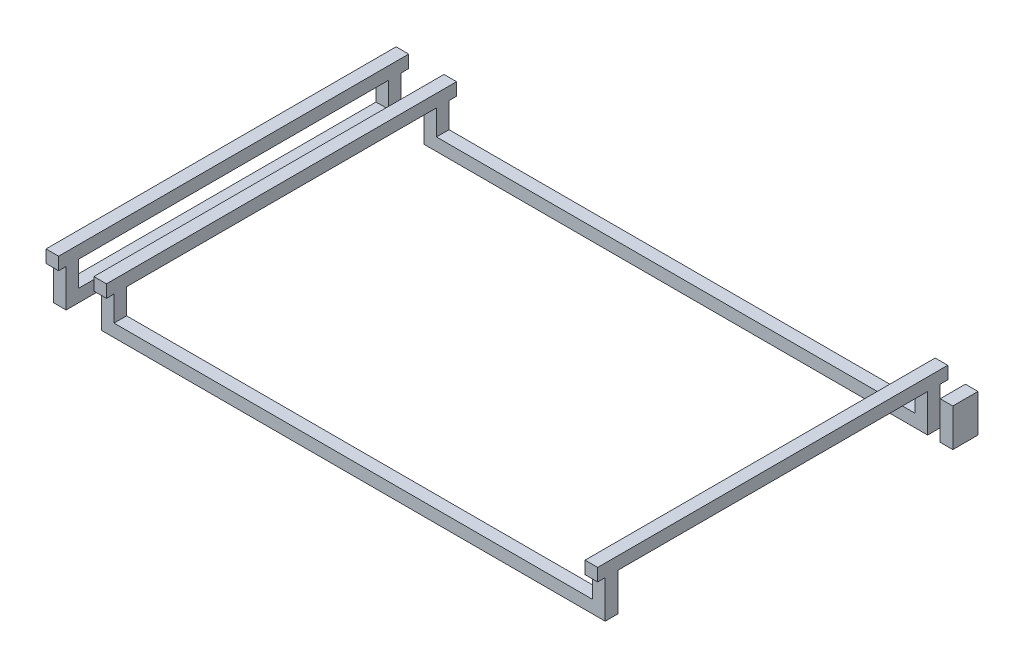
from build123d import *

# Parameters (mm, degrees)
ESQUISSE1_W                  = 1000
ESQUISSE1_H                  = 25
ESQUISSE1_W_2                = 25
ESQUISSE1_H_2                = 665
BOSS_EXTRU_1_DEPTH           = 25
ESQUISSE2_R                  = 2.75
ENL_V_MAT_EXTRU_1_DEPTH      = 2
ESQUISSE4_W                  = 25
ESQUISSE4_H                  = 25
ESQUISSE4_W_2                = 50
ESQUISSE4_H_2                = 50
BOSS_EXTRU_3_DEPTH           = 75
ESQUISSE5_W                  = 25
ESQUISSE5_H                  = 20
ESQUISSE5_H_2                = 665
ESQUISSE5_H_3                = 25
ESQUISSE5_H_4                = 45
BOSS_EXTRU_4_DEPTH           = 25
ESQUISSE7_W                  = 615
ESQUISSE7_H                  = 25
ENL_V_MAT_EXTRU_2_DEPTH      = 1188
ESQUISSE8_W                  = 25
ESQUISSE8_H                  = 25
BOSS_EXTRU_7_DEPTH           = 50
ENL_V_MAT_EXTRU_3_DEPTH      = 216
ENL_V_MAT_EXTRU_3_DEPTH_BACK = 926
ESQUISSE9_W                  = 25
ESQUISSE9_H                  = 110.20058498
ESQUISSE9_H_2                = 152.237643614
ESQUISSE10_W                 = 25
ESQUISSE10_H                 = 640
ESQUISSE10_H_2               = 25
ESQUISSE10_H_3               = 15
ESQUISSE10_H_4               = 665
BOSS_EXTRU_8_DEPTH           = 25
ESQUISSE12_W                 = 25
ESQUISSE12_H                 = 695
BOSS_EXTRU_10_DEPTH          = 25
ESQUISSE13_W                 = 25
ESQUISSE13_H                 = 25
BOSS_EXTRU_11_DEPTH          = 50
ESQUISSE14_W                 = 25
ESQUISSE14_H                 = 665
BOSS_EXTRU_12_DEPTH          = 25


with BuildPart() as part:
    # Esquisse1 → Boss.-Extru.1 (new body)
    with BuildSketch(Plane(origin=(0, 0, 0), x_dir=(1, 0, 0), z_dir=(0, 1, 0))):
        with Locations((295.960935162, -141.198785334)):
            Rectangle(ESQUISSE1_W, ESQUISSE1_H)
        with Locations((295.960935162, 498.801214666)):
            Rectangle(ESQUISSE1_W, ESQUISSE1_H)
        with Locations((-216.539064838, 178.801214666)):
            Rectangle(ESQUISSE1_W_2, ESQUISSE1_H_2)
        with Locations((808.460935162, 178.801214666)):
            Rectangle(ESQUISSE1_W_2, ESQUISSE1_H_2)
    extrude(amount=BOSS_EXTRU_1_DEPTH)

    # Esquisse2 → Enlèv. mat.-Extru.1 (cut)
    with BuildSketch(Plane(origin=(0, 25, 0), x_dir=(1, 0, 0), z_dir=(0, 1, 0))):
        with Locations(Location((-184.039064838, -141.198785334, 0), (0, 0, 270))):
            Circle(ESQUISSE2_R)
        with Locations(Location((775.960935162, -141.198785334, 0), (0, 0, 270))):
            Circle(ESQUISSE2_R)
        with Locations(Location((775.960935162, 498.801214666, 0), (0, 0, 270))):
            Circle(ESQUISSE2_R)
        with Locations(Location((-184.039064838, 498.801214666, 0), (0, 0, 270))):
            Circle(ESQUISSE2_R)
    extrude(amount=-ENL_V_MAT_EXTRU_1_DEPTH, mode=Mode.SUBTRACT)

    # Esquisse4 → Boss.-Extru.3 (add)
    with BuildSketch(Plane.XZ):
        with Locations((808.460935162, 141.198785334)):
            Rectangle(ESQUISSE4_W, ESQUISSE4_H)
        with Locations((-216.539064838, 141.198785334)):
            Rectangle(ESQUISSE4_W, ESQUISSE4_H)
        with Locations((-216.539064838, -498.801214666)):
            Rectangle(ESQUISSE4_W, ESQUISSE4_H)
        with Locations((820.960935162, -511.301214666)):
            Rectangle(ESQUISSE4_W_2, ESQUISSE4_H_2)
    extrude(amount=-BOSS_EXTRU_3_DEPTH)

    # Esquisse5 → Boss.-Extru.4 (add)
    with BuildSketch(Plane(origin=(0, 75, 0), x_dir=(1, 0, 0), z_dir=(0, 1, 0))):
        with Locations((808.460935162, -163.698785334)):
            Rectangle(ESQUISSE5_W, ESQUISSE5_H)
        with Locations((808.460935162, 203.801214666)):
            Rectangle(ESQUISSE5_W, ESQUISSE5_H_2)
        with Locations((808.460935162, -141.198785334)):
            Rectangle(ESQUISSE5_W, ESQUISSE5_H_3)
        with Locations((808.460935162, 546.301214666)):
            Rectangle(ESQUISSE5_W, ESQUISSE5_H)
        with Locations((-216.539064838, 178.801214666)):
            Rectangle(ESQUISSE5_W, ESQUISSE5_H_2)
        with Locations((-216.539064838, -163.698785334)):
            Rectangle(ESQUISSE5_W, ESQUISSE5_H)
        with Locations((-216.539064838, 533.801214666)):
            Rectangle(ESQUISSE5_W, ESQUISSE5_H_4)
    extrude(amount=BOSS_EXTRU_4_DEPTH)

    # Esquisse7 → Enlèv. mat.-Extru.2 (cut)
    with BuildSketch(Plane.ZY.offset(229.039064838)):
        with Locations((-178.801214666, 12.5)):
            Rectangle(ESQUISSE7_W, ESQUISSE7_H)
    extrude(amount=-ENL_V_MAT_EXTRU_2_DEPTH, mode=Mode.SUBTRACT)

    # Esquisse8 → Boss.-Extru.7 (add)
    with BuildSketch(Plane(origin=(0, 25, 0), x_dir=(1, 0, 0), z_dir=(0, 1, 0))):
        with Locations((783.460935162, 498.801214666)):
            Rectangle(ESQUISSE8_W, ESQUISSE8_H)
        with Locations((783.460935162, -141.198785334)):
            Rectangle(ESQUISSE8_W, ESQUISSE8_H)
        with Locations((-191.539064838, -141.198785334)):
            Rectangle(ESQUISSE8_W, ESQUISSE8_H)
        with Locations((-191.539064838, 498.801214666)):
            Rectangle(ESQUISSE8_W, ESQUISSE8_H)
    extrude(amount=BOSS_EXTRU_7_DEPTH)

    # Esquisse9 → Enlèv. mat.-Extru.3 (cut, two sides: drawn at the far end of the back side and taken through both)
    with BuildSketch(Plane(origin=(0, 0, -511.301214666), x_dir=(-1, 0, 0), z_dir=(0, 0, -1)).offset(-ENL_V_MAT_EXTRU_3_DEPTH_BACK)):
        with Locations((-808.460935162, 55.10029249)):
            Rectangle(ESQUISSE9_W, ESQUISSE9_H)
        with Locations((216.539064838, 76.118821807)):
            Rectangle(ESQUISSE9_W, ESQUISSE9_H_2)
    extrude(amount=ENL_V_MAT_EXTRU_3_DEPTH + ENL_V_MAT_EXTRU_3_DEPTH_BACK, mode=Mode.SUBTRACT)


with BuildPart() as enl_v_mat_extru_3_piece_1:
    # of the separate pieces the step leaves, piece 1, a body of its own (enl_v_mat_extru_3_pieces)
    add(part.part.solids().sort_by_distance((-204.039064838, 75, -486.301214666))[0])



with BuildPart() as enl_v_mat_extru_3_piece_2:
    # of the separate pieces the step leaves, piece 2, a body of its own (enl_v_mat_extru_3_pieces)
    add(part.part.solids().sort_by_distance((-204.039064838, 0, 153.698785334))[0])


with BuildPart() as enl_v_mat_extru_3_piece_3:
    # of the separate pieces the step leaves, piece 3, a body of its own (enl_v_mat_extru_3_pieces)
    add(part.part.solids().sort_by_distance((820.960935162, 75, -486.301214666))[0])


with BuildPart() as enl_v_mat_extru_3_piece_1_1:
    add(enl_v_mat_extru_3_piece_1.part)

    add(enl_v_mat_extru_3_piece_2.part)  # Boss.-Extru.8 merges Enlèv. mat.-Extru.3 piece 2
    # Esquisse10 → Boss.-Extru.8 (add)
    with BuildSketch(Plane(origin=(0, 75, 0), x_dir=(1, 0, 0), z_dir=(0, 1, 0))):
        with Locations((783.460935162, 191.301214666)):
            Rectangle(ESQUISSE10_W, ESQUISSE10_H)
        with Locations((783.460935162, -141.198785334)):
            Rectangle(ESQUISSE10_W, ESQUISSE10_H_2)
        with Locations((783.460935162, -161.198785334)):
            Rectangle(ESQUISSE10_W, ESQUISSE10_H_3)
        with Locations((783.460935162, 518.801214666)):
            Rectangle(ESQUISSE10_W, ESQUISSE10_H_3)
        with Locations((-191.539064838, -161.198785334)):
            Rectangle(ESQUISSE10_W, ESQUISSE10_H_3)
        with Locations((-191.539064838, 178.801214666)):
            Rectangle(ESQUISSE10_W, ESQUISSE10_H_4)
        with Locations((-191.539064838, 518.801214666)):
            Rectangle(ESQUISSE10_W, ESQUISSE10_H_3)
    extrude(amount=BOSS_EXTRU_8_DEPTH)


with BuildPart() as body_3:
    # Esquisse12 → Boss.-Extru.10 (new body)
    with BuildSketch(Plane(origin=(0, 100, 0), x_dir=(1, 0, 0), z_dir=(0, 1, 0))):
        with Locations((-286.539064838, 178.801214666)):
            Rectangle(ESQUISSE12_W, ESQUISSE12_H)
    extrude(amount=-BOSS_EXTRU_10_DEPTH)

    # Esquisse13 → Boss.-Extru.11 (add)
    with BuildSketch(Plane(origin=(0, 75, 0), x_dir=(-1, 0, 0), z_dir=(0, -1, 0))):
        with Locations((286.539064838, 498.801214666)):
            Rectangle(ESQUISSE13_W, ESQUISSE13_H)
        with Locations((286.539064838, -141.198785334)):
            Rectangle(ESQUISSE13_W, ESQUISSE13_H)
    extrude(amount=BOSS_EXTRU_11_DEPTH)

    # Esquisse14 → Boss.-Extru.12 (add)
    with BuildSketch(Plane(origin=(0, 25, 0), x_dir=(-1, 0, 0), z_dir=(0, -1, 0))):
        with Locations((286.539064838, 178.801214666)):
            Rectangle(ESQUISSE14_W, ESQUISSE14_H)
    extrude(amount=BOSS_EXTRU_12_DEPTH)


solid = Compound([enl_v_mat_extru_3_piece_3.part, enl_v_mat_extru_3_piece_1_1.part, body_3.part])
